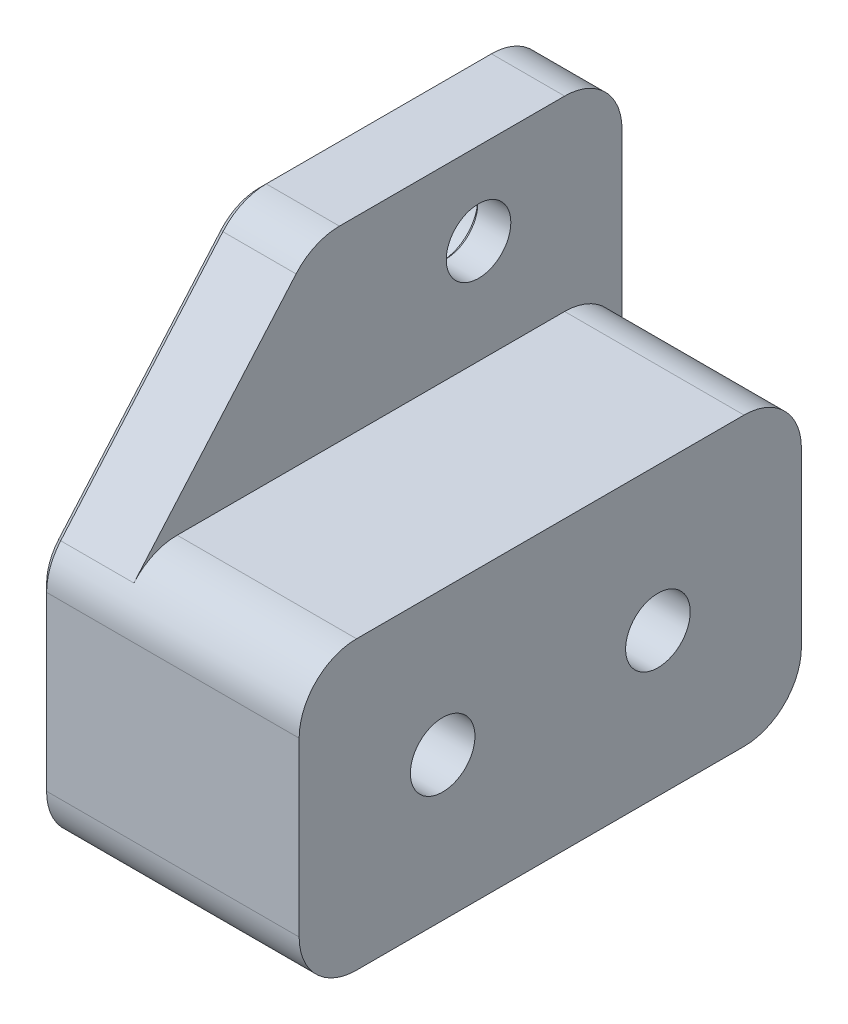
from build123d import *

# Parameters (mm, degrees)
SKETCH1_R           = 2.25
BOSS_EXTRUDE1_DEPTH = 2.6
BOSS_EXTRUDE3_START = -3
SKETCH3_R           = 3.75
BOSS_EXTRUDE3_DEPTH = 3
CHAMFER2_SIZE       = 0.3
CHAMFER3_SIZE       = 0.5
SKETCH4_R           = 2.25
BOSS_EXTRUDE4_DEPTH = 12.5


with BuildPart() as part:
    # Sketch1 → Boss-Extrude1 (new body)
    with BuildSketch(Plane(origin=(0, 0, 0), x_dir=(0, 0, -1), z_dir=(1, 0, 0))):
        with BuildLine():
            Line((-21, -10), (6, -10))
            ThreePointArc((6, -10), (8.828427125, -8.828427125), (10, -6))
            Line((10, -6), (10, 19))
            ThreePointArc((10, 19), (8.828427125, 21.828427125), (6, 23))
            Line((6, 23), (-9.695652174, 23))
            ThreePointArc((-9.695652174, 23), (-11.354136506, 22.63997661), (-12.714074263, 21.62471486))
            Line((-12.714074263, 21.62471486), (-24.018422089, 8.62471486))
            ThreePointArc((-24.018422089, 8.62471486), (-24.746577662, 7.401126626), (-25, 6))
            Line((-25, 6), (-25, -6))
            ThreePointArc((-25, -6), (-23.828427125, -8.828427125), (-21, -10))
        make_face()
        with Locations((-15, 0)):
            Circle(SKETCH1_R, mode=Mode.SUBTRACT)
        with Locations((0, 17.25)):
            Circle(SKETCH1_R, mode=Mode.SUBTRACT)
        Circle(SKETCH1_R, mode=Mode.SUBTRACT)
    extrude(amount=BOSS_EXTRUDE1_DEPTH)

    # Sketch3 → Boss-Extrude3 (add)
    with BuildSketch(Plane(origin=(0, 0, 0), x_dir=(0, 0, -1), z_dir=(1, 0, 0)).offset(BOSS_EXTRUDE3_START)):
        with BuildLine():
            Line((-21, -10), (6, -10))
            ThreePointArc((6, -10), (8.828427125, -8.828427125), (10, -6))
            Line((10, -6), (10, 19))
            ThreePointArc((10, 19), (8.828427125, 21.828427125), (6, 23))
            Line((6, 23), (-9.695652174, 23))
            ThreePointArc((-9.695652174, 23), (-11.354136506, 22.63997661), (-12.714074263, 21.62471486))
            Line((-12.714074263, 21.62471486), (-24.018422089, 8.62471486))
            ThreePointArc((-24.018422089, 8.62471486), (-24.746577662, 7.401126626), (-25, 6))
            Line((-25, 6), (-25, -6))
            ThreePointArc((-25, -6), (-23.828427125, -8.828427125), (-21, -10))
        make_face()
        with Locations((-15, 0)):
            Circle(SKETCH3_R, mode=Mode.SUBTRACT)
        Circle(SKETCH3_R, mode=Mode.SUBTRACT)
        with Locations((0, 17.25)):
            Circle(SKETCH3_R, mode=Mode.SUBTRACT)
    extrude(amount=BOSS_EXTRUDE3_DEPTH)

    # Chamfer2
    chamfer2_edges = [part.edges().sort_by_distance(p)[0] for p in [
        (0, 0, 17.25),
        (0, 17.25, 2.25),
        (0, 0, 2.25),
        (0, 0, 18.75),
        (0, 0, 3.75),
        (0, 17.25, 3.75),
    ]]
    chamfer(chamfer2_edges, length=CHAMFER2_SIZE)

    # Chamfer3
    chamfer3_edges = [part.edges().sort_by_distance(p)[0] for p in [
        (-3, -8.828427125, 23.828427125),
        (-3, 0, 25),
        (-3, 7.401126626, 24.746577662),
        (-3, 15.12471486, 18.366248176),
        (-3, 22.63997661, 11.354136506),
        (-3, 23, 1.847826087),
        (-3, 21.828427125, -8.828427125),
        (-3, 6.5, -10),
        (-3, -8.828427125, -8.828427125),
        (-3, -10, 7.5),
        (-3, 17.25, 3.75),
        (-3, 0, 3.75),
        (-3, 0, 18.75),
    ]]
    chamfer(chamfer3_edges, length=CHAMFER3_SIZE)

    # Sketch4 → Boss-Extrude4 (add)
    with BuildSketch(Plane(origin=(2.6, 0, 0), x_dir=(0, 0, -1), z_dir=(1, 0, 0))):
        with BuildLine():
            Line((-21, -10), (6, -10))
            ThreePointArc((6, -10), (8.828427125, -8.828427125), (10, -6))
            Line((10, -6), (10, 6))
            ThreePointArc((10, 6), (8.828427125, 8.828427125), (6, 10))
            Line((6, 10), (-21, 10))
            ThreePointArc((-21, 10), (-23.828427125, 8.828427125), (-25, 6))
            Line((-25, 6), (-25, -6))
            ThreePointArc((-25, -6), (-23.828427125, -8.828427125), (-21, -10))
        make_face()
        Circle(SKETCH4_R, mode=Mode.SUBTRACT)
        with Locations((-15, 0)):
            Circle(SKETCH4_R, mode=Mode.SUBTRACT)
    extrude(amount=BOSS_EXTRUDE4_DEPTH)


solid = part.part
